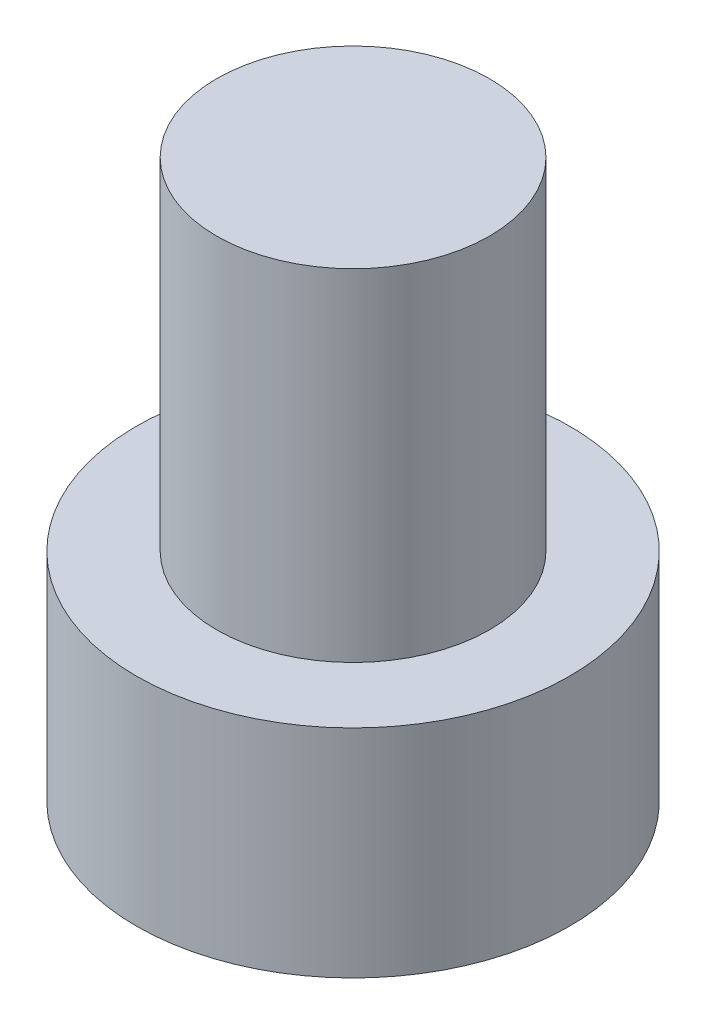
from build123d import *

# Parameters (mm, degrees)
SKETCH1_R           = 3.175
BOSS_EXTRUDE1_DEPTH = 3.175
SKETCH2_R           = 2
BOSS_EXTRUDE2_DEPTH = 5


with BuildPart() as part:
    # Sketch1 → Boss-Extrude1 (new body)
    with BuildSketch(Plane(origin=(0, 0, 0), x_dir=(1, 0, 0), z_dir=(0, 1, 0))):
        with Locations(Location((0, 0, 0), (0, 0, 270))):
            Circle(SKETCH1_R)
    extrude(amount=BOSS_EXTRUDE1_DEPTH)

    # Sketch2 → Boss-Extrude2 (add)
    with BuildSketch(Plane(origin=(0, 3.175, 0), x_dir=(1, 0, 0), z_dir=(0, 1, 0))):
        with Locations(Location((0, 0, 0), (0, 0, 270))):
            Circle(SKETCH2_R)
    extrude(amount=BOSS_EXTRUDE2_DEPTH)


solid = part.part
